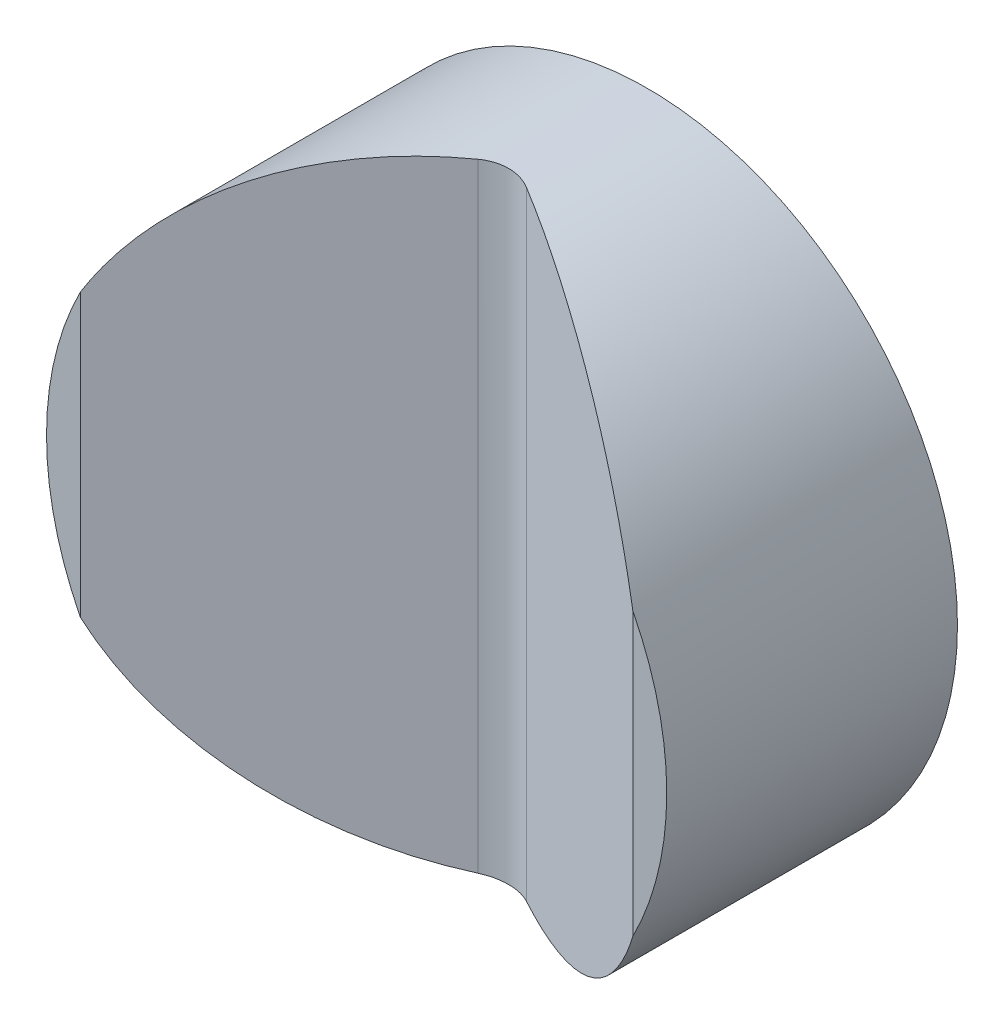
from build123d import *

# Parameters (mm, degrees)
CUT_EXTRUDE1_DEPTH = 35


with BuildPart() as part:
    # Sketch1 → Revolve1 (revolve)
    with BuildSketch(Plane(origin=(0, 0, 0), x_dir=(0, 0, -1), z_dir=(1, 0, 0)), mode=Mode.PRIVATE) as revolve1_sk:
        Polygon((8, 0), (8, 6), (0, 6), (0, 32), (-30, 32), (-30, 0), align=None)
    revolve(revolve1_sk.sketch.rotate(Axis((0, 0, -8), (0, 0, -1)), 90), axis=Axis((0, 0, -8), (0, 0, -1)))

    # Sketch2 → Cut-Extrude1 (cut, symmetric)
    with BuildSketch(Plane(origin=(0, 0, 0), x_dir=(1, 0, 0), z_dir=(0, 1, 0))):
        with BuildLine():
            Line((-28.5, -30), (-2.5, -14.988893001))
            ThreePointArc((-2.5, -14.988893001), (0, -14.31902002), (2.5, -14.988893001))
            Line((2.5, -14.988893001), (28.5, -30))
            Line((28.5, -30), (-28.5, -30))
        make_face()
    extrude(amount=CUT_EXTRUDE1_DEPTH, both=True, mode=Mode.SUBTRACT)


solid = part.part
